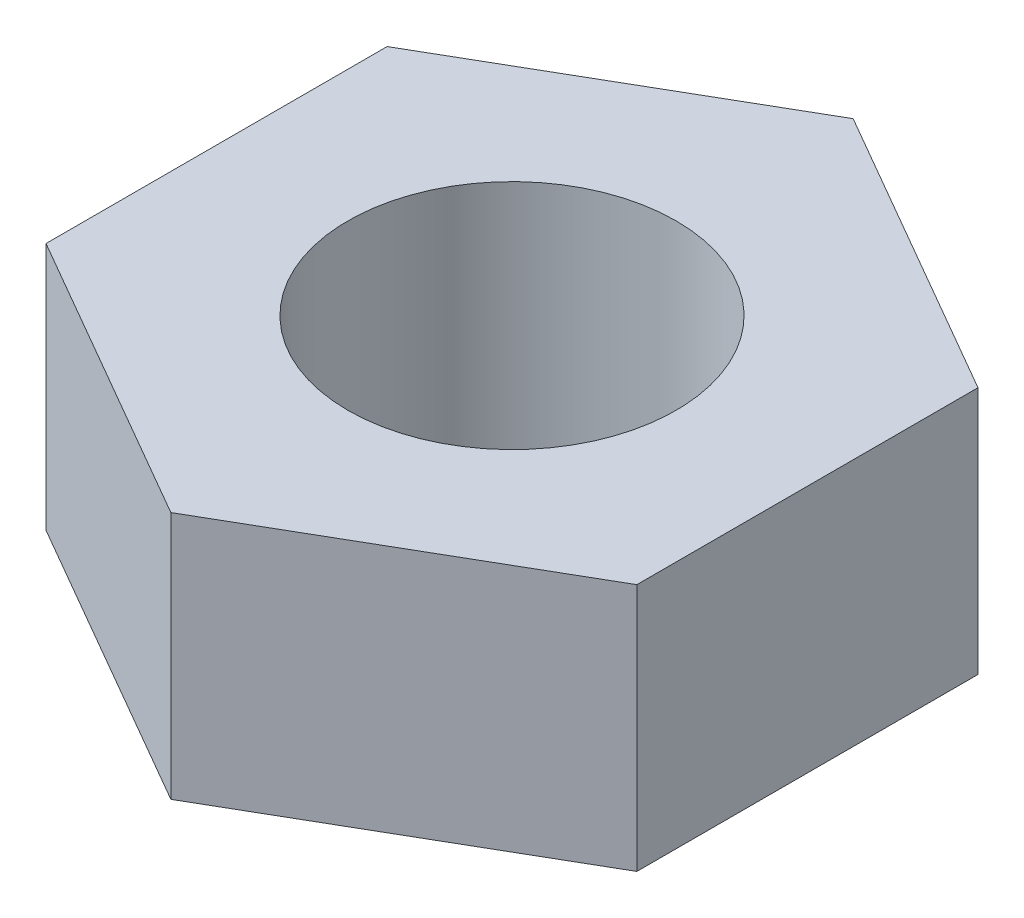
from build123d import *

# Parameters (mm, degrees)
SKETCH1_R           = 1.5
BOSS_EXTRUDE1_DEPTH = 2.27


with BuildPart() as part:
    # Sketch1 → Boss-Extrude1 (new body)
    with BuildSketch(Plane(origin=(0, 0, 0), x_dir=(1, 0, 0), z_dir=(0, 1, 0))):
        Polygon((0, -3.117691454), (2.7, -1.558845727), (2.7, 1.558845727), (0, 3.117691454), (-2.7, 1.558845727), (-2.7, -1.558845727), align=None)
        with Locations(Location((0, 0, 0), (0, 0, 270))):
            Circle(SKETCH1_R, mode=Mode.SUBTRACT)
    extrude(amount=BOSS_EXTRUDE1_DEPTH)


solid = part.part
